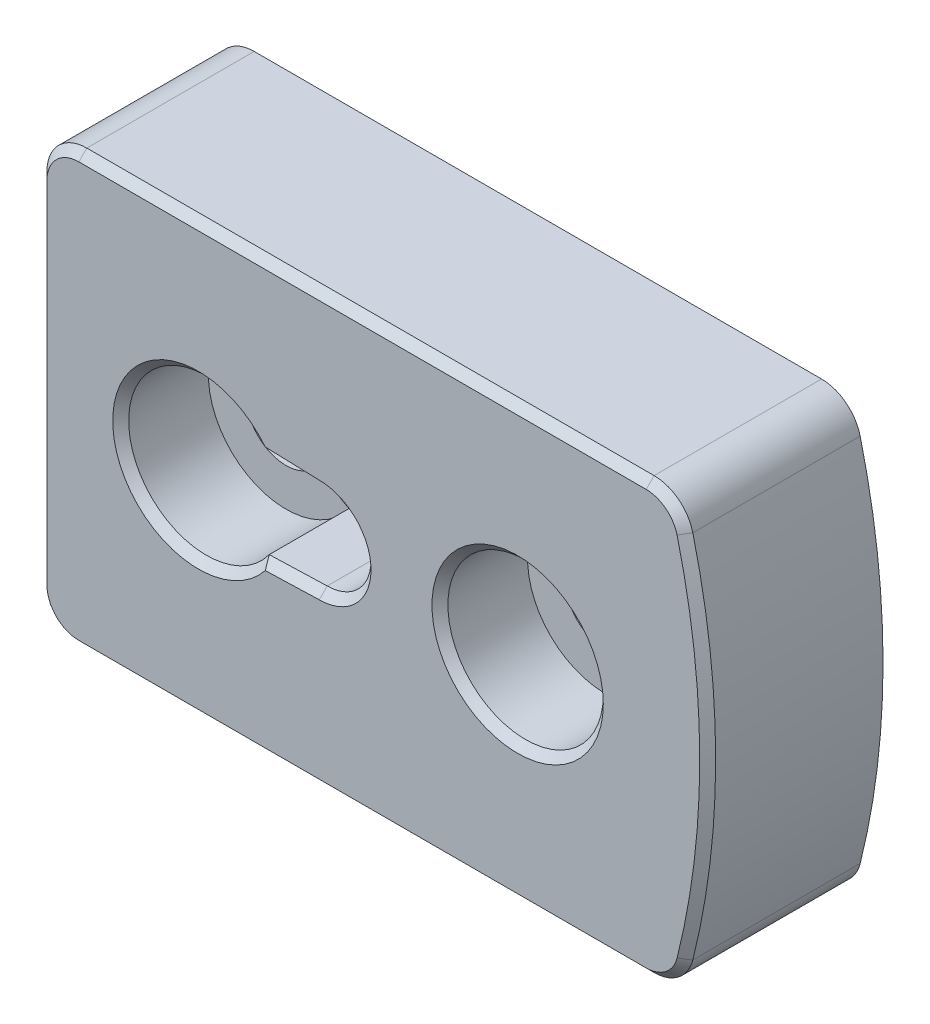
from build123d import *

# Parameters (mm, degrees)
BOSS_EXTRUDE1_DEPTH     = 11
SKETCH2_R               = 2.5
CUT_EXTRUDE1_DEPTH      = 29.018788339
SKETCH3_R               = 4.875
CUT_EXTRUDE2_DEPTH      = 5.5
SKETCH4_R               = 2.75
CUT_EXTRUDE3_DEPTH      = 29.018788339
CUT_EXTRUDE4_DEPTH      = 5.5
FILLET1_R               = 2.5
CHAMFER1_SIZE           = 0.5
CUT_EXTRUDE5_DEPTH      = 29.018788339
CUT_EXTRUDE5_DEPTH_BACK = 29.018788339
CHAMFER3_SIZE           = 0.5


with BuildPart() as part:
    # Sketch1 → Boss-Extrude1 (new body)
    with BuildSketch(Plane.XY):
        with BuildLine():
            Line((-20, -13.5), (20, -13.5))
            ThreePointArc((20, -13.5), (21.95, 0), (20, 13.5))
            Line((20, 13.5), (-20, 13.5))
            Line((-20, 13.5), (-20, -13.5))
        make_face()
    extrude(amount=BOSS_EXTRUDE1_DEPTH)

    # Sketch2 → Cut-Extrude1 (cut, through all)
    with BuildSketch(Plane.XY.offset(11)):
        with Locations((-10, 0)):
            Circle(SKETCH2_R)
        with Locations((10.026646142, 0)):
            Circle(SKETCH2_R)
    extrude(amount=-CUT_EXTRUDE1_DEPTH, mode=Mode.SUBTRACT)

    # Sketch3 → Cut-Extrude2 (cut)
    with BuildSketch(Plane.XY.offset(11)):
        with Locations((-10, 0)):
            Circle(SKETCH3_R)
        with Locations((10.026646142, 0)):
            Circle(SKETCH3_R)
    extrude(amount=-CUT_EXTRUDE2_DEPTH, mode=Mode.SUBTRACT)

    # Sketch4 → Cut-Extrude3 (cut, through all)
    with BuildSketch(Plane.XY.offset(11)):
        with Locations((-2.42, 0)):
            Circle(SKETCH4_R)
    extrude(amount=-CUT_EXTRUDE3_DEPTH, mode=Mode.SUBTRACT)

    # Sketch5 → Cut-Extrude4 (cut)
    with BuildSketch(Plane(origin=(0, 0, 0), x_dir=(-1, 0, 0), z_dir=(0, 0, -1))):
        Polygon((6.72, -2.482606158), (6.72, 2.482606158), (2.42, 4.965212315), (-1.88, 2.482606158), (-1.88, -2.482606158), (2.42, -4.965212315), align=None)
    extrude(amount=-CUT_EXTRUDE4_DEPTH, mode=Mode.SUBTRACT)

    # Fillet1
    fillet1_edges = [part.edges().sort_by_distance(p)[0] for p in [
        (20, -13.5, 5.5),
        (-20, -13.5, 5.5),
        (-20, 13.5, 5.5),
        (20, 13.5, 5.5),
    ]]
    fillet(fillet1_edges, radius=FILLET1_R)

    # Chamfer1
    chamfer1_edges = [part.edges().sort_by_distance(p)[0] for p in [
        (0.295627716, -13.5, 11),
        (-20, 0, 11),
        (21.95, 0, 11),
        (0.295627716, 13.5, 11),
        (19.628977191, 12.971144792, 11),
        (19.628977191, -12.971144792, 11),
        (-19.267766953, 12.767766953, 11),
        (-19.267766953, -12.767766953, 11),
    ]]
    chamfer(chamfer1_edges, length=CHAMFER1_SIZE)

    # Sketch6 → Cut-Extrude5 (cut, two sides: drawn at the far end of the back side and taken through both)
    with BuildSketch(Plane.XY.offset(11).offset(-CUT_EXTRUDE5_DEPTH_BACK)):
        with BuildLine():
            Line((-6.05629261, 2.865797798), (-2.42, 2.75))
            ThreePointArc((-2.42, 2.75), (0.33, 0), (-2.42, -2.75))
            Line((-2.42, -2.75), (-6.05629261, -2.865797798))
            Line((-6.05629261, -2.865797798), (-6.72, -2.482606158))
            Line((-6.72, -2.482606158), (-6.72, 2.482606158))
            Line((-6.72, 2.482606158), (-6.05629261, 2.865797798))
        make_face()
    extrude(amount=CUT_EXTRUDE5_DEPTH + CUT_EXTRUDE5_DEPTH_BACK, mode=Mode.SUBTRACT)

    # Chamfer3
    chamfer3_edges = [part.edges().sort_by_distance(p)[0] for p in [
        (0.33, 0, 11),
        (-14.875, 0, 11),
        (-4.238146305, 2.807898899, 11),
        (-4.238146305, -2.807898899, 11),
        (5.151646142, 0, 11),
    ]]
    chamfer(chamfer3_edges, length=CHAMFER3_SIZE)


solid = part.part
